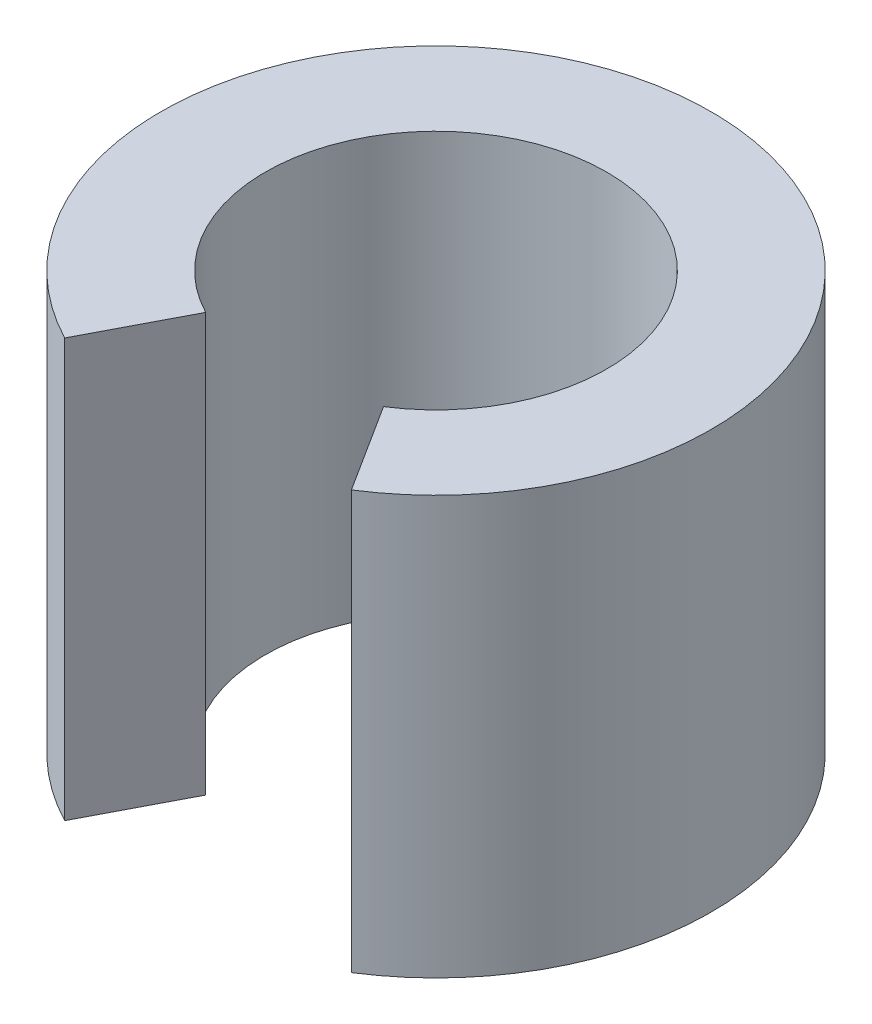
from build123d import *

# Parameters (mm, degrees)
BOSS_EXTRUDE1_DEPTH = 6


with BuildPart() as part:
    # Sketch1 → Boss-Extrude1 (new body)
    with BuildSketch(Plane(origin=(0, 0, 0), x_dir=(1, 0, 0), z_dir=(0, 1, 0))):
        with BuildLine():
            Line((-1.133286716, -2.172132873), (-1.827135726, -3.502010142))
            ThreePointArc((-1.827135726, -3.502010142), (-0.168659116, 3.946397611), (2.119261884, -3.333351026))
            Line((2.119261884, -3.333351026), (1.31447889, -2.067521523))
            ThreePointArc((1.31447889, -2.067521523), (-0.10461135, 2.447765607), (-1.133286716, -2.172132873))
        make_face()
    extrude(amount=BOSS_EXTRUDE1_DEPTH)


solid = part.part
